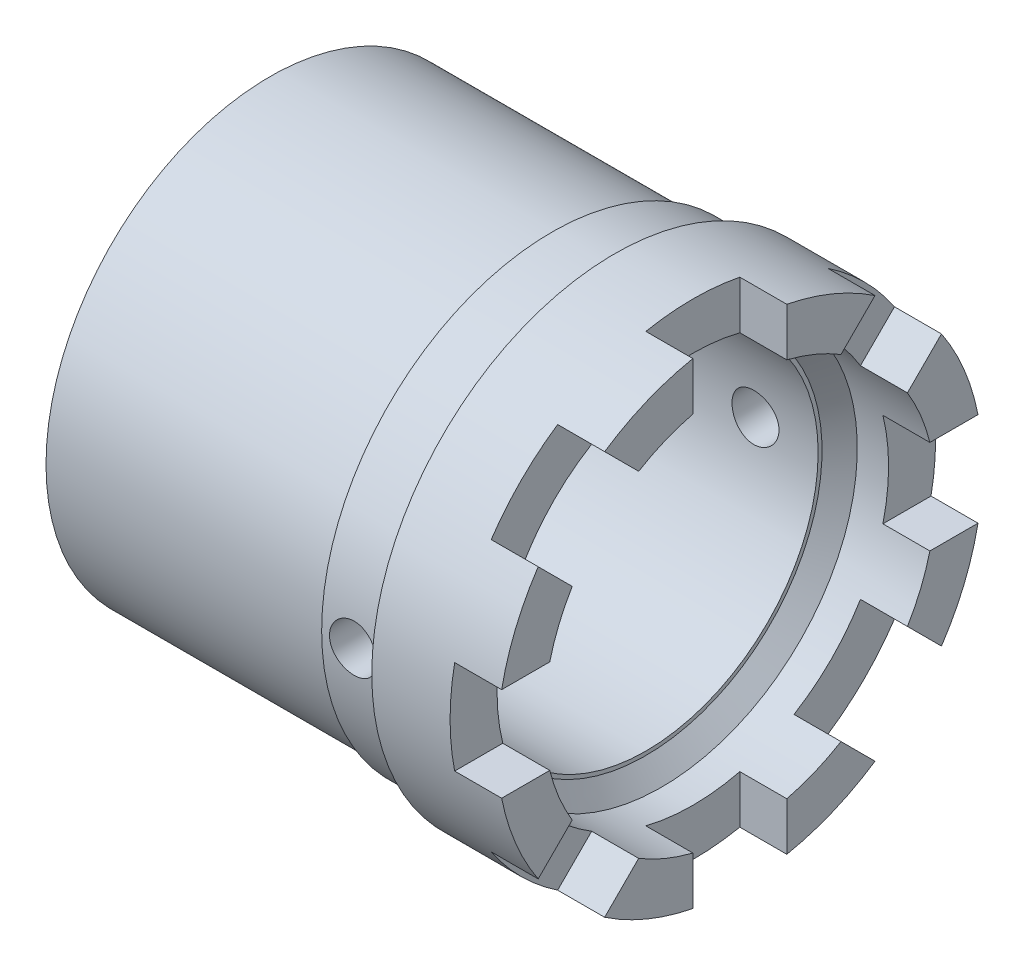
from build123d import *

# Parameters (mm, degrees)
ESQUISSE2_W                  = 6
ESQUISSE2_H                  = 7
ENL_V_MAT_EXTRU_1_DEPTH      = 3
R_P_TITION_CIRCULAIRE1_COUNT = 8
ESQUISSE3_R                  = 1.5
ENL_V_MAT_EXTRU_2_DEPTH      = 50.563091106


with BuildPart() as part:
    # Esquisse1 → Base-Révolution (revolve)
    with BuildSketch(Plane.XY, mode=Mode.PRIVATE) as base_r_volution_sk:
        Polygon((-24, 11), (0, 11), (0, 11.25), (1, 12.5), (6, 12.5), (6, 15.5), (-2, 15.5), (-2.5, 14.7), (-6, 14.7), (-6, 14.3), (-24, 14.3), align=None)
    revolve(base_r_volution_sk.sketch.rotate(Axis((0, 0, 0), (1, 0, 0)), 90), axis=Axis((0, 0, 0), (1, 0, 0)))

    # Esquisse2 → Enlèv. mat.-Extru.1 (cut)
    with BuildSketch(Plane(origin=(6, 0, 0), x_dir=(0, 0, -1), z_dir=(1, 0, 0))):
        with Locations((0, 13.5)):
            Rectangle(ESQUISSE2_W, ESQUISSE2_H)
    enl_v_mat_extru_1 = extrude(amount=-ENL_V_MAT_EXTRU_1_DEPTH, mode=Mode.SUBTRACT)

    # Répétition circulaire1: Enlèv. mat.-Extru.1 ×8 about axis
    r_p_tition_circulaire1_axis = Axis((0, 0, 0), (1, 0, 0))
    for i in range(1, R_P_TITION_CIRCULAIRE1_COUNT):
        add(enl_v_mat_extru_1.rotate(r_p_tition_circulaire1_axis, i * 360 / R_P_TITION_CIRCULAIRE1_COUNT), mode=Mode.SUBTRACT)

    # Esquisse3 → Enlèv. mat.-Extru.2 (cut, through all)
    with BuildSketch(Plane.XY.offset(25)):
        with Locations((-4, 0)):
            Circle(ESQUISSE3_R)
    extrude(amount=-ENL_V_MAT_EXTRU_2_DEPTH, mode=Mode.SUBTRACT)


solid = part.part
